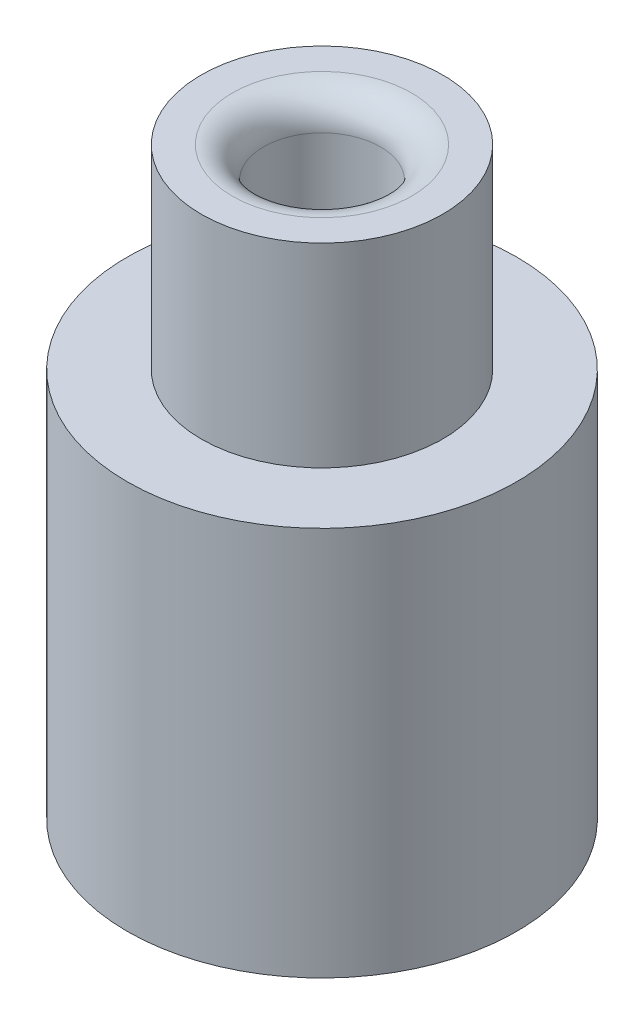
from build123d import *

# Parameters (mm, degrees)
BOSS_EXTRU_1_DEPTH      = 6
BOSS_EXTRU_1_DEPTH_BACK = 4
ESQUISSE1_R             = 5
BOSS_EXTRU_2_DEPTH      = 5
BOSS_EXTRU_2_DEPTH_BACK = 1
ESQUISSE2_R             = 3.1
ESQUISSE3_R             = 1.5
ENL_V_MAT_EXTRU_2_DEPTH = 10
ESQUISSE4_R             = 2.25
ENL_V_MAT_EXTRU_3_DEPTH = 5
CONG_1_R                = 0.8


with BuildPart() as part:
    # Esquisse1 → Boss.-Extru.1 (new, two sides: drawn at the far end of the back side and taken through both)
    with BuildSketch(Plane(origin=(0, 0, 0), x_dir=(1, 0, 0), z_dir=(0, 1, 0)).offset(-BOSS_EXTRU_1_DEPTH_BACK)):
        with Locations(Location((0, 0, 0), (0, 0, 270))):
            Circle(ESQUISSE1_R)
    extrude(amount=BOSS_EXTRU_1_DEPTH + BOSS_EXTRU_1_DEPTH_BACK)

    # Esquisse2 → Boss.-Extru.2 (add, two sides: drawn at the far end of the back side and taken through both)
    with BuildSketch(Plane(origin=(0, 6, 0), x_dir=(1, 0, 0), z_dir=(0, 1, 0)).offset(-BOSS_EXTRU_2_DEPTH_BACK)):
        with Locations(Location((0, 0, 0), (0, 0, 270))):
            Circle(ESQUISSE2_R)
    extrude(amount=BOSS_EXTRU_2_DEPTH + BOSS_EXTRU_2_DEPTH_BACK)

    # Esquisse3 → Enlèv. mat.-Extru.2 (cut)
    with BuildSketch(Plane(origin=(0, 11, 0), x_dir=(1, 0, 0), z_dir=(0, 1, 0))):
        with Locations(Location((0, 0, 0), (0, 0, 270))):
            Circle(ESQUISSE3_R)
    extrude(amount=-ENL_V_MAT_EXTRU_2_DEPTH, mode=Mode.SUBTRACT)

    # Esquisse4 → Enlèv. mat.-Extru.3 (cut)
    with BuildSketch(Plane.XZ.offset(4)):
        with Locations(Location((0, 0, 0), (0, 0, 270))):
            Circle(ESQUISSE4_R)
    extrude(amount=-ENL_V_MAT_EXTRU_3_DEPTH, mode=Mode.SUBTRACT)

    # Congé1
    cong_1_edges = [part.edges().sort_by_distance(p)[0] for p in [
        (0, 11, -1.5),
    ]]
    fillet(cong_1_edges, radius=CONG_1_R)


solid = part.part
